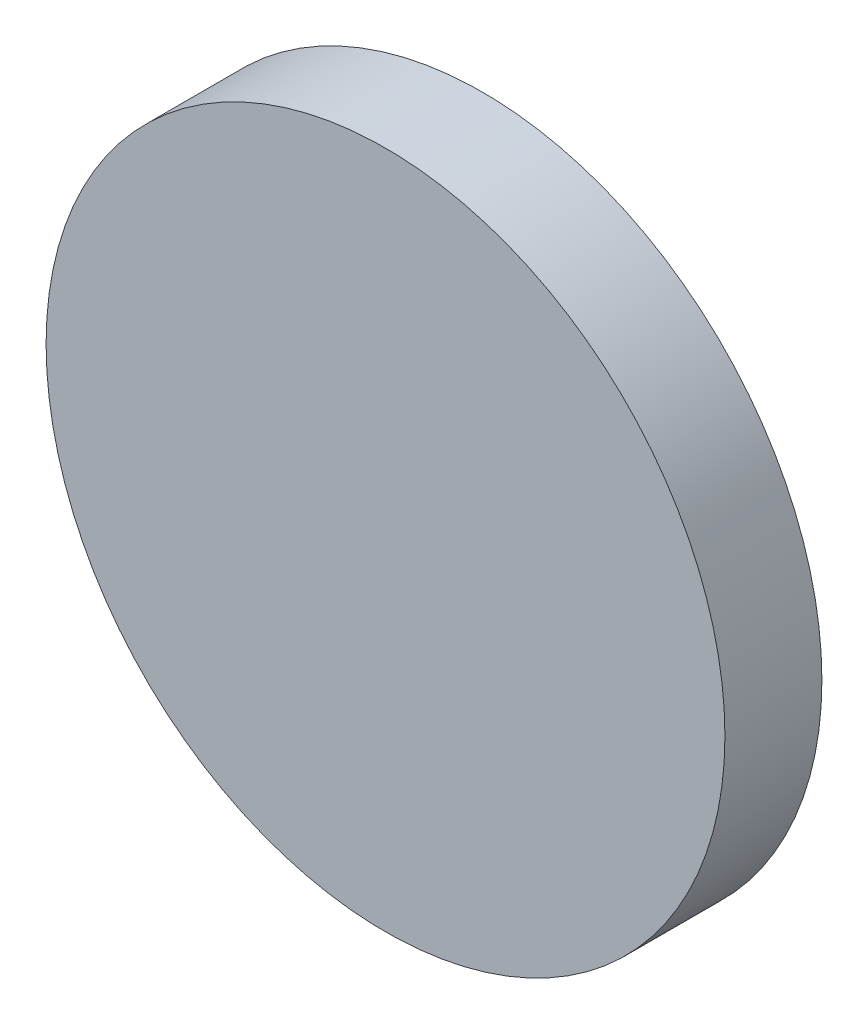
from build123d import *

# Parameters (mm, degrees)
SKETCH_1_R      = 70
EXTRUDE_1_DEPTH = 20


with BuildPart() as part:
    # 草图1 → 凸台-拉伸1 (new body)
    with BuildSketch(Plane.XY):
        Circle(SKETCH_1_R)
    extrude(amount=EXTRUDE_1_DEPTH)


solid = part.part
